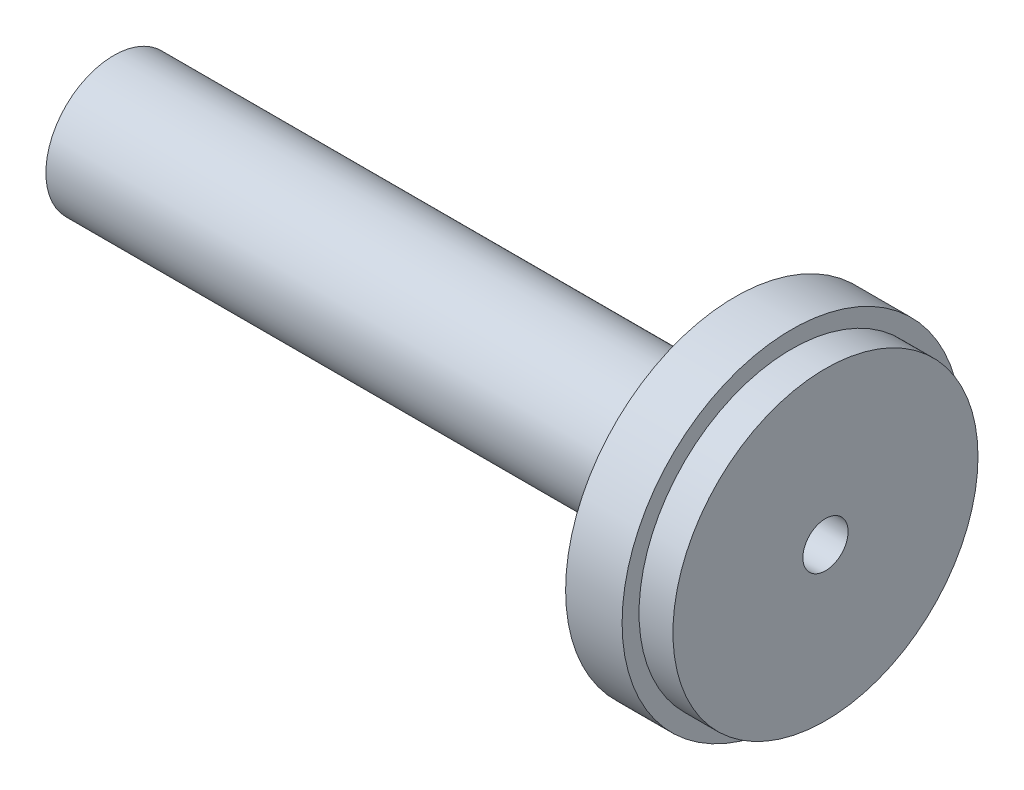
from build123d import *


with BuildPart() as part:
    # Sketch1 → Revolve1 (revolve)
    with BuildSketch(Plane.XY, mode=Mode.PRIVATE) as revolve1_sk:
        Polygon((1.887739405, -2), (-61.112260595, 0), (-61.112260595, 2), (-6.112260595, 2), (-6.112260595, 11), (-1.112260595, 11), (-1.112260595, 9.5), (1.887739405, 9.5), align=None)
    revolve(revolve1_sk.sketch.rotate(Axis((1.887739405, -4, 0), (-1, 0, 0)), 90), axis=Axis((1.887739405, -4, 0), (-1, 0, 0)))


solid = part.part
